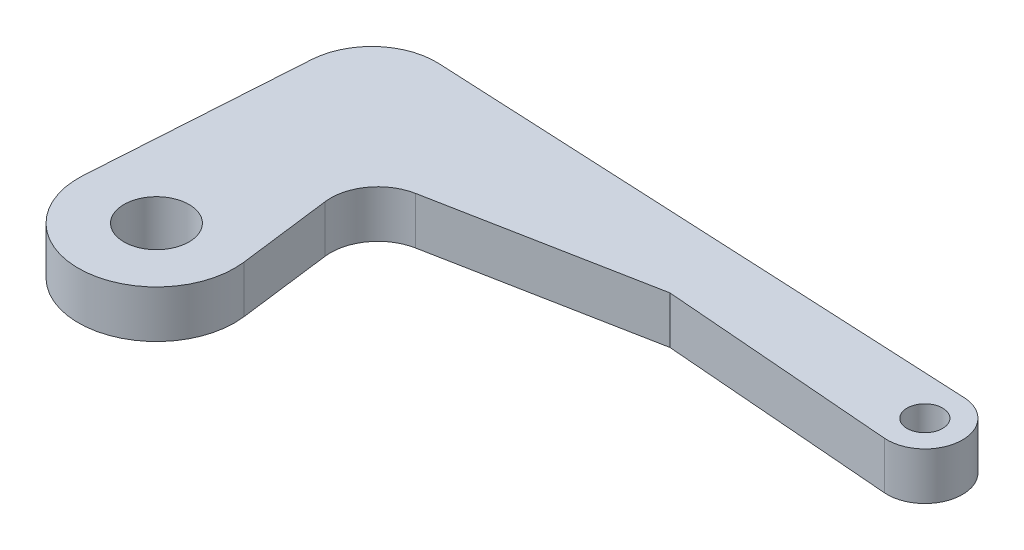
from build123d import *

# Parameters (mm, degrees)
SKETCH1_R           = 2.75
SKETCH1_R_2         = 1.5
BOSS_EXTRUDE1_DEPTH = 4


with BuildPart() as part:
    # Sketch1 → Boss-Extrude1 (new body)
    with BuildSketch(Plane(origin=(0, 0, 0), x_dir=(1, 0, 0), z_dir=(0, 1, 0))):
        with BuildLine():
            Line((-5.42452127, 18.55232243), (-6.592163913, 0.424614729))
            ThreePointArc((-6.592163913, 0.424614729), (0.204408635, -6.602661572), (6.553274043, 0.831578043))
            Line((6.553274043, 0.831578043), (5.554165127, 8.705083814))
            ThreePointArc((5.554165127, 8.705083814), (6.283820074, 11.556382789), (8.766792184, 13.136620645))
            Line((8.766792184, 13.136620645), (26.80965439, 16.607175604))
            Line((26.80965439, 16.607175604), (46.521475319, 15.034505243))
            ThreePointArc((46.521475319, 15.034505243), (49.9462455, 17.999804862), (46.927651625, 21.377695275))
            Line((46.927651625, 21.377695275), (0.262324785, 23.632347033))
            ThreePointArc((0.262324785, 23.632347033), (-3.621288531, 22.256778313), (-5.42452127, 18.55232243))
        make_face()
        with Locations(Location((0, 0, 0), (0, 0, 270))):
            Circle(SKETCH1_R, mode=Mode.SUBTRACT)
        with Locations(Location((46.774261136, 18.202917946, 0), (0, 0, 270))):
            Circle(SKETCH1_R_2, mode=Mode.SUBTRACT)
    extrude(amount=BOSS_EXTRUDE1_DEPTH)


solid = part.part
